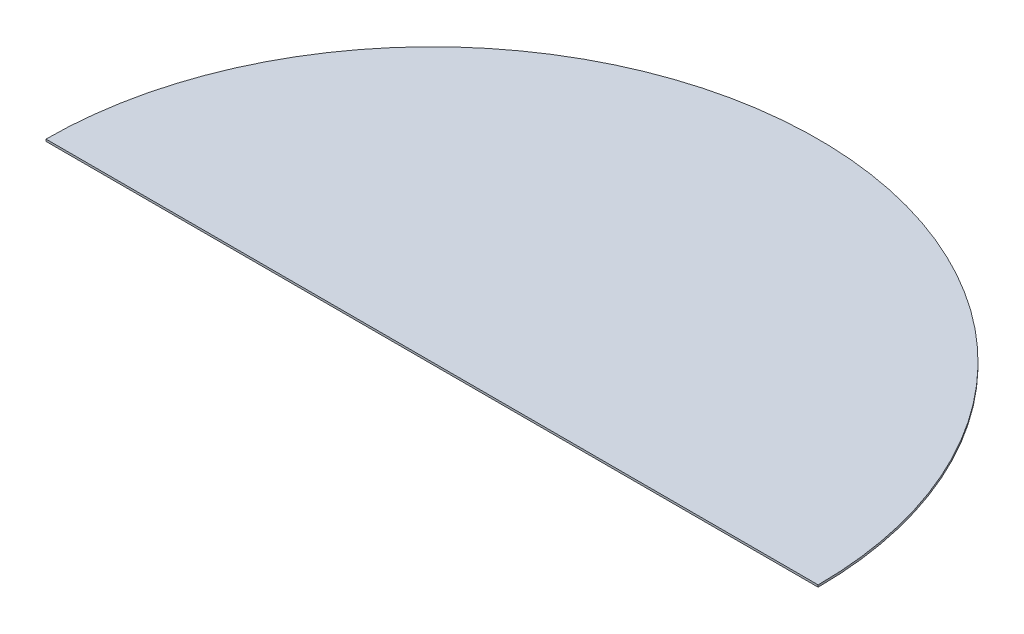
from build123d import *

# Parameters (mm, degrees)
BOSS_EXTRUDE1_DEPTH = 3.175


with BuildPart() as part:
    # Sketch1 → Boss-Extrude1 (new body)
    with BuildSketch(Plane(origin=(0, 0, 0), x_dir=(1, 0, 0), z_dir=(0, 1, 0))):
        with BuildLine():
            Line((-600, 0), (600, 0))
            ThreePointArc((600, 0), (0, 600), (-600, 0))
        make_face()
    extrude(amount=BOSS_EXTRUDE1_DEPTH)


solid = part.part
